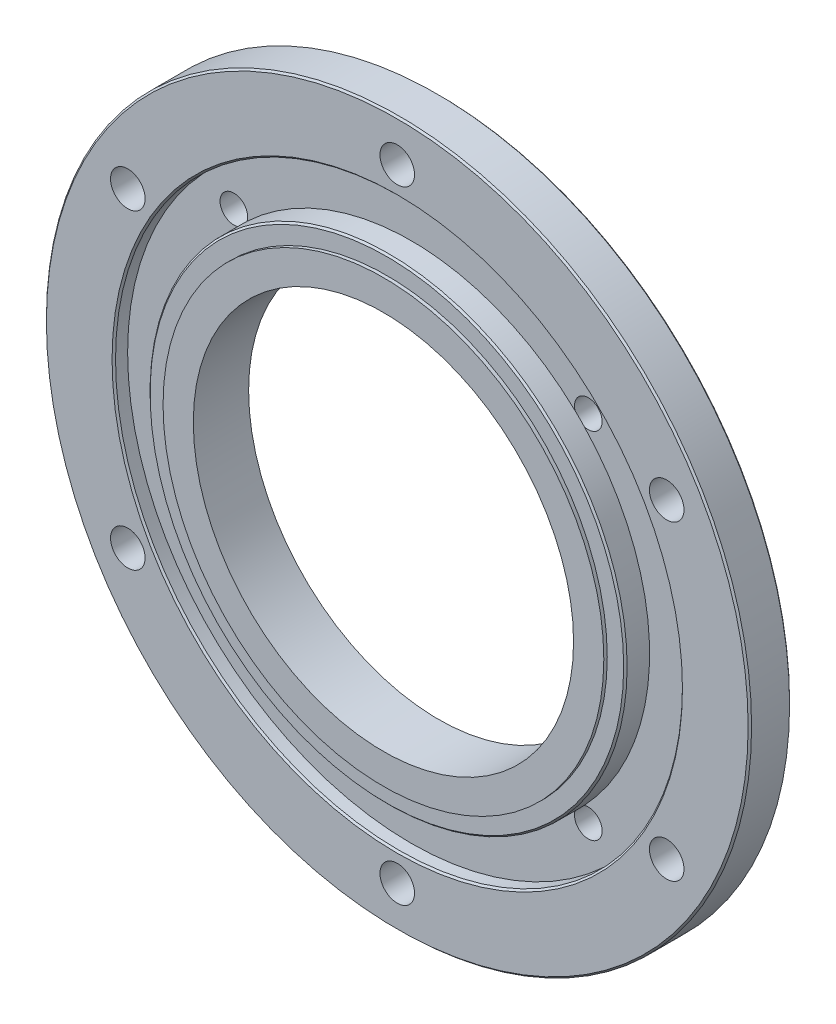
from build123d import *

# Parameters (mm, degrees)
SKETCH_1_R          = 102
EXTRUDE_1_DEPTH     = 12
SKETCH_2_R          = 69
EXTRUDE_2_DEPTH     = 3
CUT_EXTRUDE_START   = -4
SKETCH_3_R          = 82
SKETCH_3_R_2        = 69
CUT_EXTRUDE_2_DEPTH = 4
SKETCH_4_R          = 63.75
EXTRUDE_3_DEPTH     = 1
CHAMFER_1_SIZE      = 0.5
SKETCH_5_R          = 5
CUT_EXTRUDE_3_DEPTH = 41
SKETCH_6_R          = 55
CUT_EXTRUDE_4_DEPTH = 51
SKETCH_7_R          = 4
CUT_EXTRUDE_5_DEPTH = 8


with BuildPart() as part:
    # 草图1 → 拉伸1 (new body)
    with BuildSketch(Plane.XY):
        Circle(SKETCH_1_R)
    extrude(amount=EXTRUDE_1_DEPTH)

    # 草图2 → 拉伸2 (add)
    with BuildSketch(Plane.XY.offset(12)):
        Circle(SKETCH_2_R)
    extrude(amount=EXTRUDE_2_DEPTH)

    # 草图3 → 切除-拉伸2 (cut)
    with BuildSketch(Plane.XY.offset(12).offset(CUT_EXTRUDE_START)):
        Circle(SKETCH_3_R)
        Circle(SKETCH_3_R_2, mode=Mode.SUBTRACT)
    extrude(amount=CUT_EXTRUDE_2_DEPTH, mode=Mode.SUBTRACT)

    # 草图4 → 拉伸3 (add)
    with BuildSketch(Plane.XY.offset(15)):
        Circle(SKETCH_4_R)
    extrude(amount=EXTRUDE_3_DEPTH)

    # 倒角1
    chamfer_1_edges = [part.edges().sort_by_distance(p)[0] for p in [
        (-82, 0, 12),
        (-102, 0, 0),
        (-102, 0, 12),
        (-69, 0, 15),
    ]]
    chamfer(chamfer_1_edges, length=CHAMFER_1_SIZE)

    # 草图5 → 切除-拉伸3 (cut)
    with BuildSketch(Plane(origin=(0, 0, 0), x_dir=(-1, 0, 0), z_dir=(0, 0, -1))):
        with Locations((0, 90)):
            Circle(SKETCH_5_R)
        with Locations((77.942286341, 45)):
            Circle(SKETCH_5_R)
        with Locations((77.942286341, -45)):
            Circle(SKETCH_5_R)
        with Locations((0, -90)):
            Circle(SKETCH_5_R)
        with Locations((-77.942286341, -45)):
            Circle(SKETCH_5_R)
        with Locations((-77.942286341, 45)):
            Circle(SKETCH_5_R)
    extrude(amount=-CUT_EXTRUDE_3_DEPTH, mode=Mode.SUBTRACT)

    # 草图6 → 切除-拉伸4 (cut)
    with BuildSketch(Plane(origin=(0, 0, 0), x_dir=(-1, 0, 0), z_dir=(0, 0, -1))):
        Circle(SKETCH_6_R)
    extrude(amount=-CUT_EXTRUDE_4_DEPTH, mode=Mode.SUBTRACT)

    # 草图7 → 切除-拉伸5 (cut)
    with BuildSketch(Plane(origin=(0, 0, 0), x_dir=(-1, 0, 0), z_dir=(0, 0, -1))):
        with Locations((51.265241636, 51.265241636)):
            Circle(SKETCH_7_R)
        with Locations((51.265241636, -51.265241636)):
            Circle(SKETCH_7_R)
        with Locations((-51.265241636, -51.265241636)):
            Circle(SKETCH_7_R)
        with Locations((-51.265241636, 51.265241636)):
            Circle(SKETCH_7_R)
    extrude(amount=-CUT_EXTRUDE_5_DEPTH, mode=Mode.SUBTRACT)


solid = part.part
